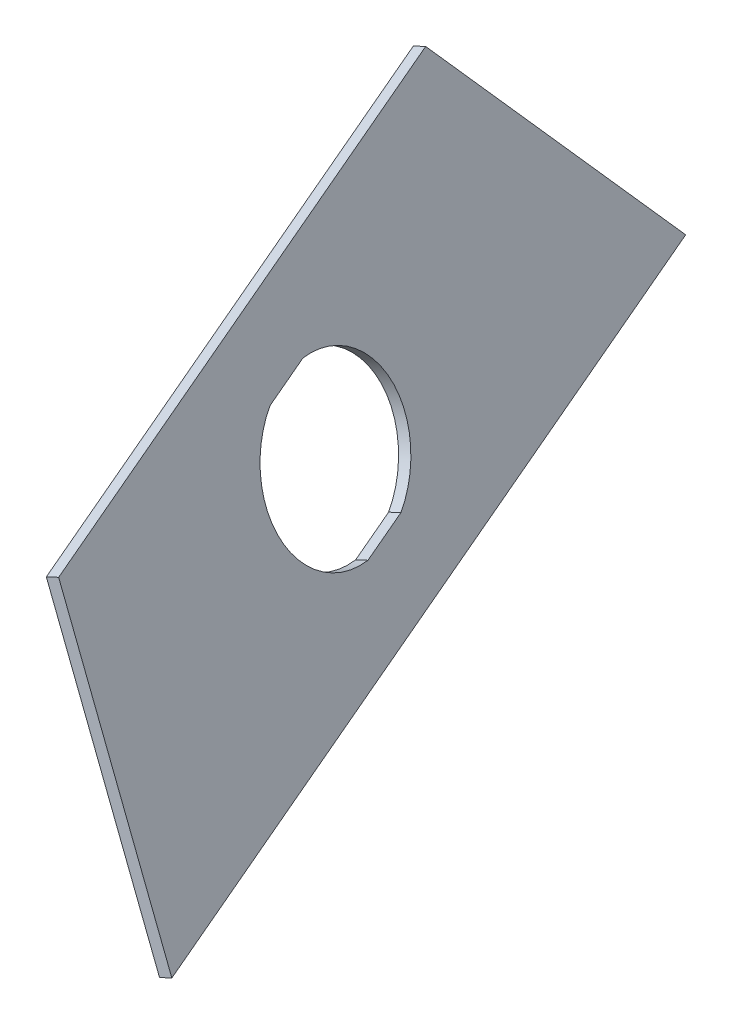
from build123d import *

# Parameters (mm, degrees)
BOSS_EXTRUDE1_DEPTH = 1.5875


with BuildPart() as part:
    # Sketch40 → Boss-Extrude1 (new body)
    with BuildSketch(Plane(origin=(-456.955039877, 178.120588246, -67.48659487), x_dir=(-0.1270105543825624, 0.04950857893190621, 0.9906650390962515), z_dir=(-0.9230204054682253, 0.35979237176022855, -0.13631867191409483))):
        Polygon((-143.227084656, 906.623268698), (-170.661347691, 874.056453533), (-74.641427067, 839.002915601), (-74.641427067, 881.585027318), align=None)
        with BuildLine():
            Line((-115.271977523, 886.304578524), (-109.11217167, 884.055847358))
            ThreePointArc((-109.11217167, 884.055847358), (-105.459844174, 871.54470512), (-116.313665717, 864.329254051))
            Line((-116.313665717, 864.329254051), (-122.47347157, 866.577985217))
            ThreePointArc((-122.47347157, 866.577985217), (-126.125799067, 879.089127455), (-115.271977523, 886.304578524))
        make_face(mode=Mode.SUBTRACT)
    extrude(amount=BOSS_EXTRUDE1_DEPTH)


with BuildPart() as body_2:
    # Mirror2: mirrored copy
    add(part.part.mirror(Plane(origin=(0, 0, 0), x_dir=(0, 0, 1), z_dir=(1, 0, 0))))


solid = body_2.part
